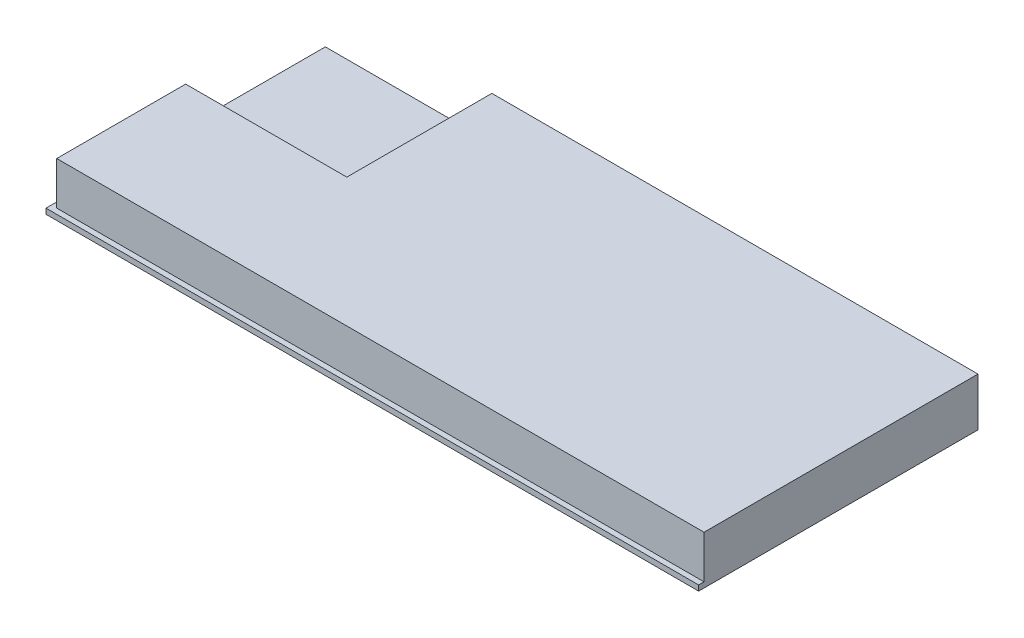
from build123d import *

# Parameters (mm, degrees)
SKETCH_1_W      = 6075
SKETCH_1_H      = 2600
EXTRUDE_1_DEPTH = 50
EXTRUDE_2_DEPTH = 400


with BuildPart() as part:
    # 草图1 → 凸台-拉伸1 (new body)
    with BuildSketch(Plane(origin=(0, 0, 0), x_dir=(1, 0, 0), z_dir=(0, 1, 0))):
        with Locations((-3037.5, 0)):
            Rectangle(SKETCH_1_W, SKETCH_1_H)
    extrude(amount=EXTRUDE_1_DEPTH)

    # 草图2 → 凸台-拉伸2 (add)
    with BuildSketch(Plane(origin=(0, 50, 0), x_dir=(1, 0, 0), z_dir=(0, 1, 0))):
        Polygon((0, 1300), (0, -1250), (-6025, -1250), (-6025, -50), (-4525, -50), (-4525, 1300), align=None)
    extrude(amount=EXTRUDE_2_DEPTH)


solid = part.part
